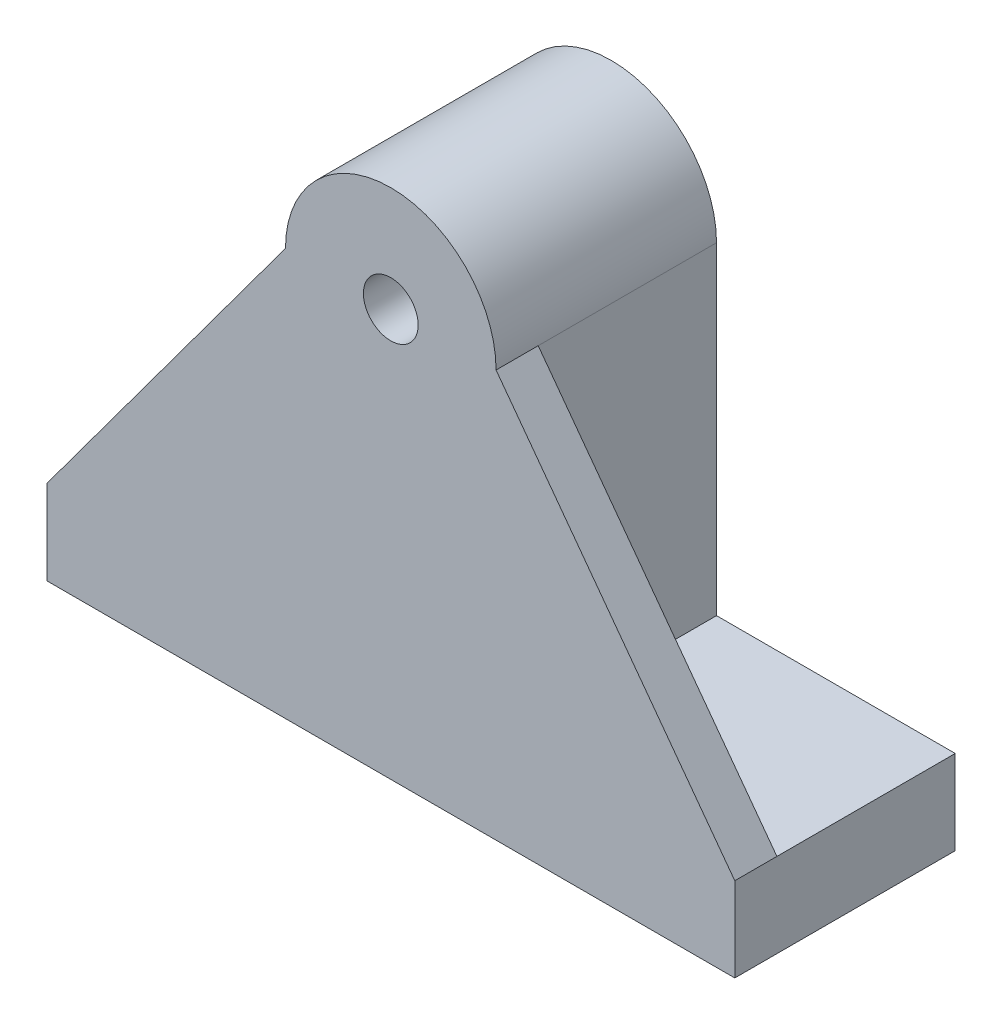
from build123d import *

# Parameters (mm, degrees)
MAIN_BODY_DEPTH    = 10.5
RIB1_REACH         = 45.385
SKETCH2_WALL_W     = 117.37050971
SKETCH2_WALL_H     = 3
SKETCH3_R          = 7.5
SHAFT_DEPTH        = 8
CUT_EXTRUDE1_START = -5.3
CUT_EXTRUDE1_DEPTH = 5.3
CUT_EXTRUDE2_START = -13.3
SKETCH6_R          = 7.5
CUT_EXTRUDE2_DEPTH = 13.3
SKETCH7_R          = 1.95
CUT_EXTRUDE3_DEPTH = 42.082112896


with BuildPart() as part:
    # Sketch1 → Main Body (new, symmetric)
    with BuildSketch(Plane.XY):
        with BuildLine():
            Line((-7.5, 0), (-7.5, -29))
            Line((-7.5, -29), (24.5, -29))
            Line((24.5, -29), (24.5, -23))
            Line((24.5, -23), (7.5, -23))
            Line((7.5, -23), (7.5, 0))
            ThreePointArc((7.5, 0), (0, 7.5), (-7.5, 0))
        make_face()
    main_body = extrude(amount=MAIN_BODY_DEPTH, both=True)

    # Sketch2 wall → Rib1 (add, up to next)
    with BuildSketch(Plane(origin=(16, -11.5, 10.5), x_dir=(0.594391061084, -0.804176141466, 0), z_dir=(0.804176141466, 0.594391061084, 0)), mode=Mode.PRIVATE) as rib1_sk1:
        with Locations((0, 1.5)):
            Rectangle(SKETCH2_WALL_W, SKETCH2_WALL_H)
    rib1_tool1 = extrude(rib1_sk1.sketch, amount=-RIB1_REACH, mode=Mode.PRIVATE) - part.part
    rib1 = rib1_tool1.solids().sort_by_distance((16, -11.5, 10.5))[0]
    add(rib1)

    # Sketch3 → Shaft (add)
    with BuildSketch(Plane.XY.offset(-10.5)):
        Circle(SKETCH3_R)
    extrude(amount=-SHAFT_DEPTH)

    # Mirror2: Main Body, Rib1 across plane
    add(main_body.mirror(Plane(origin=(0, 0, 0), x_dir=(0, 0, 1), z_dir=(1, 0, 0))))
    add(rib1.mirror(Plane(origin=(0, 0, 0), x_dir=(0, 0, 1), z_dir=(1, 0, 0))))

    # Sketch5 → Cut-Extrude1 (cut)
    with BuildSketch(Plane(origin=(0, 0, -10.5), x_dir=(-1, 0, 0), z_dir=(0, 0, -1)).offset(CUT_EXTRUDE1_START)):
        with BuildLine():
            Line((-7.5, 0), (-7.5, -23))
            Line((-7.5, -23), (-24.5, -23))
            Line((-24.5, -23), (-24.5, -29))
            Line((-24.5, -29), (24.5, -29))
            Line((24.5, -29), (24.5, -23))
            Line((24.5, -23), (7.5, -23))
            Line((7.5, -23), (7.5, 0))
            ThreePointArc((7.5, 0), (0, -7.5), (-7.5, 0))
        make_face()
    extrude(amount=CUT_EXTRUDE1_DEPTH, mode=Mode.SUBTRACT)

    # Sketch6 → Cut-Extrude2 (cut)
    with BuildSketch(Plane(origin=(0, 0, -18.5), x_dir=(-1, 0, 0), z_dir=(0, 0, -1)).offset(CUT_EXTRUDE2_START)):
        Circle(SKETCH6_R)
    extrude(amount=CUT_EXTRUDE2_DEPTH, mode=Mode.SUBTRACT)

    # Sketch7 → Cut-Extrude3 (cut, through all)
    with BuildSketch(Plane.XY.offset(10.5)):
        Circle(SKETCH7_R)
    extrude(amount=-CUT_EXTRUDE3_DEPTH, mode=Mode.SUBTRACT)


solid = part.part
